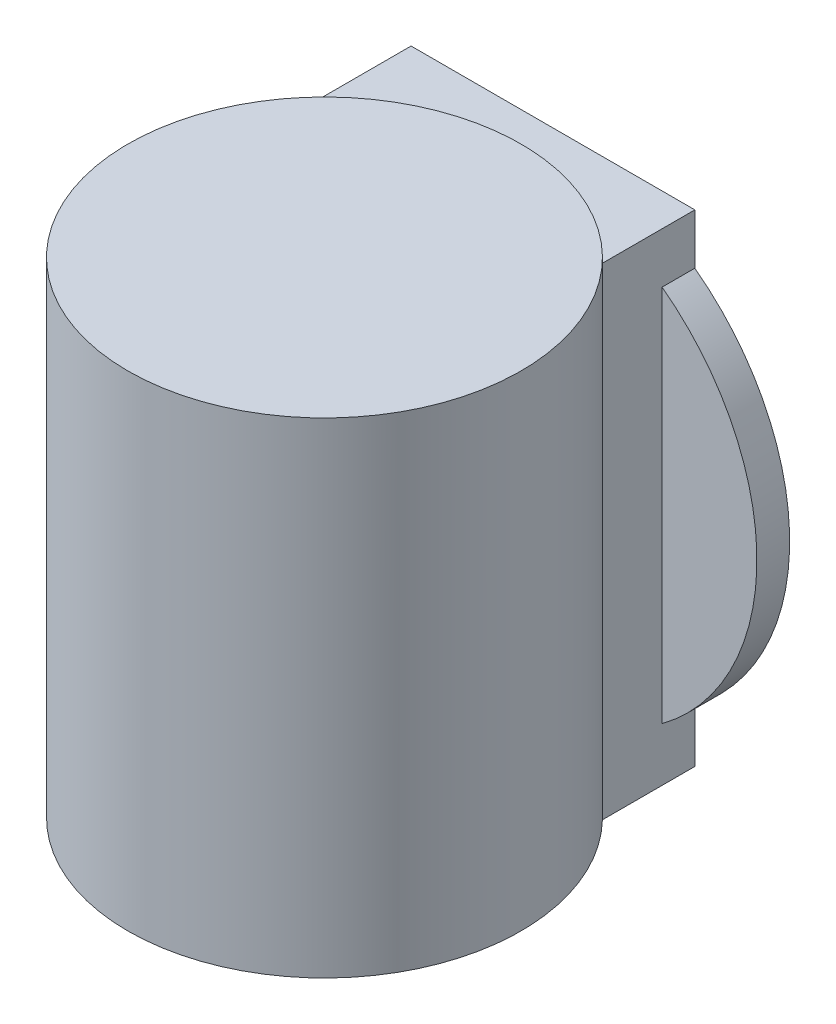
from build123d import *

# Parameters (mm, degrees)
BOSS_EXTRUDE1_DEPTH      = 0.037
BOSS_EXTRUDE1_DEPTH_BACK = 0.037
SKETCH1_R                = 0.02999071
SKETCH2_W                = 0.043295271
SKETCH2_H                = 0.073549039
BOSS_EXTRUDE2_DEPTH      = 0.035
BOSS_EXTRUDE3_START      = -0.03
SKETCH2_3_R              = 0.035976834
BOSS_EXTRUDE3_DEPTH      = 0.005
SKETCH3_R                = 0.014860666
SKETCH3_R_2              = 0.005248218
BOSS_EXTRUDE4_DEPTH      = 0.0385
SKETCH3_2_R              = 0.005248218
BOSS_EXTRUDE5_DEPTH      = 0.043


with BuildPart() as part:
    # Sketch1 → Boss-Extrude1 (new, two sides: drawn at the far end of the back side and taken through both)
    with BuildSketch(Plane(origin=(0, 0, 0), x_dir=(1, 0, 0), z_dir=(0, 1, 0)).offset(-BOSS_EXTRUDE1_DEPTH_BACK)):
        Circle(SKETCH1_R)
    extrude(amount=BOSS_EXTRUDE1_DEPTH + BOSS_EXTRUDE1_DEPTH_BACK)

    # Sketch2 → Boss-Extrude2 (add)
    with BuildSketch(Plane.XY):
        with Locations((-0.000136275, -0.00022548)):
            Rectangle(SKETCH2_W, SKETCH2_H)
    extrude(amount=-BOSS_EXTRUDE2_DEPTH)

    # Sketch2<3> → Boss-Extrude3 (add)
    with BuildSketch(Plane.XY.offset(BOSS_EXTRUDE3_START)):
        Circle(SKETCH2_3_R)
    extrude(amount=-BOSS_EXTRUDE3_DEPTH)

    # Sketch3 → Boss-Extrude4 (add)
    with BuildSketch(Plane.XY):
        Circle(SKETCH3_R)
        Circle(SKETCH3_R_2, mode=Mode.SUBTRACT)
    extrude(amount=-BOSS_EXTRUDE4_DEPTH)

    # Sketch3<2> → Boss-Extrude5 (add)
    with BuildSketch(Plane.XY):
        Circle(SKETCH3_2_R)
    extrude(amount=-BOSS_EXTRUDE5_DEPTH)


solid = part.part
